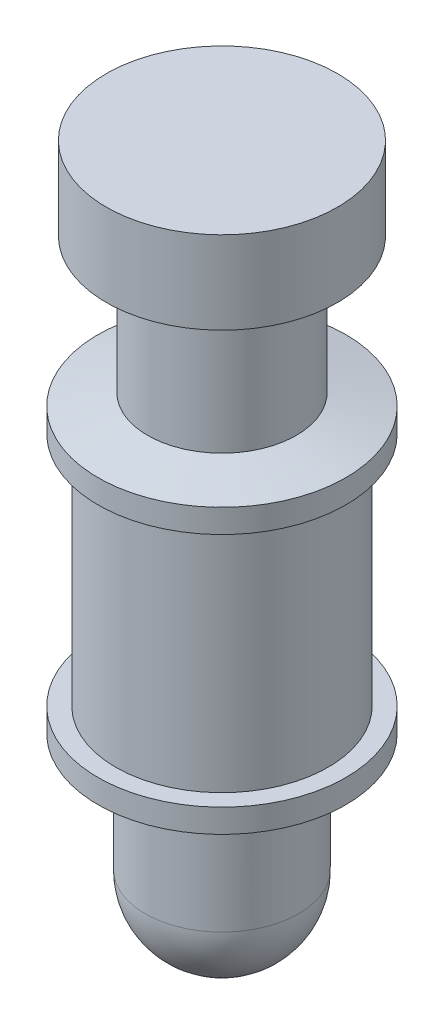
from build123d import *


with BuildPart() as part:
    # Sketch1 → Cabeza_cuello_tambor (revolve)
    with BuildSketch(Plane.XY, mode=Mode.PRIVATE) as cabeza_cuello_tambor_sk:
        Polygon((0, 3.5), (9.8, 3.5), (9.8, -3.5), (6.3, -5), (6.3, -15), (10.5, -16), (10.5, -18), (9, -18), (9, -38), (10.5, -38), (10.5, -40), (6.5, -41), (6.5, -50), (0, -50), align=None)
    revolve(cabeza_cuello_tambor_sk.sketch.rotate(Axis((0, -54, 0), (0, 1, 0)), 90), axis=Axis((0, -54, 0), (0, 1, 0)))

    # Sketch2 → Union_diafisis (revolve)
    with BuildSketch(Plane.XY):
        with BuildLine():
            Line((0, -56.5), (0, -43.5))
            ThreePointArc((0, -43.5), (6.5, -50), (0, -56.5))
        make_face()
    revolve(axis=Axis((0, -60.5, 0), (0, 1, 0)))


solid = part.part
